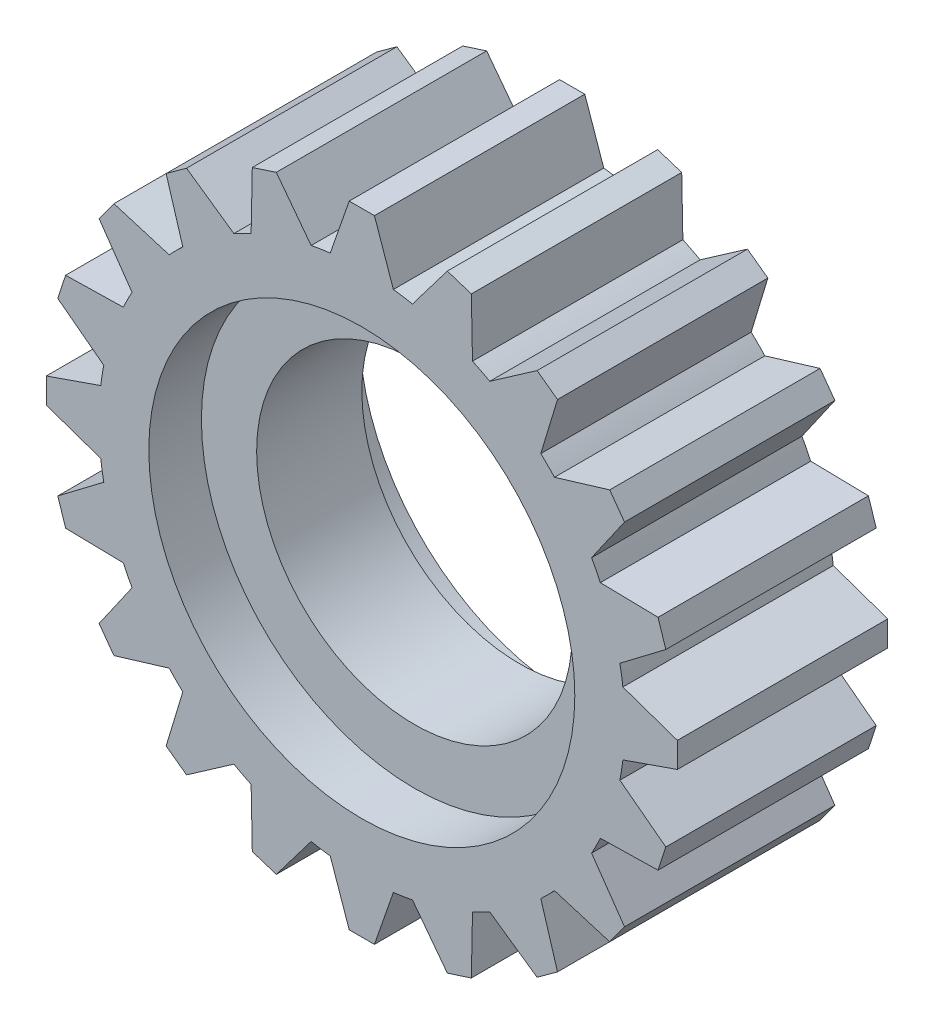
from build123d import *

# Parameters (mm, degrees)
BOSS_EXTRUDE1_DEPTH      = 10
BOSS_EXTRUDE1_DEPTH_BACK = 10
SKETCH1_R                = 15
SKETCH2_R                = 20.25
CUT_EXTRUDE1_DEPTH       = 5


with BuildPart() as part:
    # Sketch1 → Boss-Extrude1 (new, two sides: drawn at the far end of the back side and taken through both)
    with BuildSketch(Plane.XY.offset(-BOSS_EXTRUDE1_DEPTH_BACK)):
        with BuildLine():
            Line((-1.2, 30), (1.2, 30))
            Line((1.2, 30), (3, 24.819347292))
            ThreePointArc((3, 24.819347292), (3.910861626, 24.692208515), (4.816430554, 24.531652955))
            Line((4.816430554, 24.531652955), (8.129242012, 28.902515882))
            Line((8.129242012, 28.902515882), (10.411777651, 28.160875096))
            Line((10.411777651, 28.160875096), (10.522769651, 22.677550989))
            ThreePointArc((10.522769651, 22.677550989), (11.349762493, 22.275163105), (12.161395327, 21.842629505))
            Line((12.161395327, 21.842629505), (16.662737176, 24.975852134))
            Line((16.662737176, 24.975852134), (18.604377962, 23.565167528))
            Line((18.604377962, 23.565167528), (17.015497293, 18.315917992))
            ThreePointArc((17.015497293, 18.315917992), (17.67766953, 17.67766953), (18.315917992, 17.015497293))
            Line((18.315917992, 17.015497293), (23.565167528, 18.604377962))
            Line((23.565167528, 18.604377962), (24.975852134, 16.662737176))
            Line((24.975852134, 16.662737176), (21.842629505, 12.161395327))
            ThreePointArc((21.842629505, 12.161395327), (22.275163105, 11.349762493), (22.677550989, 10.522769651))
            Line((22.677550989, 10.522769651), (28.160875096, 10.411777651))
            Line((28.160875096, 10.411777651), (28.902515882, 8.129242012))
            Line((28.902515882, 8.129242012), (24.531652955, 4.816430554))
            ThreePointArc((24.531652955, 4.816430554), (24.692208515, 3.910861626), (24.819347292, 3))
            Line((24.819347292, 3), (30, 1.2))
            Line((30, 1.2), (30, -1.2))
            Line((30, -1.2), (24.819347292, -3))
            ThreePointArc((24.819347292, -3), (24.692208515, -3.910861626), (24.531652955, -4.816430554))
            Line((24.531652955, -4.816430554), (28.902515882, -8.129242012))
            Line((28.902515882, -8.129242012), (28.160875096, -10.411777651))
            Line((28.160875096, -10.411777651), (22.677550989, -10.522769651))
            ThreePointArc((22.677550989, -10.522769651), (22.275163105, -11.349762493), (21.842629505, -12.161395327))
            Line((21.842629505, -12.161395327), (24.975852134, -16.662737176))
            Line((24.975852134, -16.662737176), (23.565167528, -18.604377962))
            Line((23.565167528, -18.604377962), (18.315917992, -17.015497293))
            ThreePointArc((18.315917992, -17.015497293), (17.67766953, -17.67766953), (17.015497293, -18.315917992))
            Line((17.015497293, -18.315917992), (18.604377962, -23.565167528))
            Line((18.604377962, -23.565167528), (16.662737176, -24.975852134))
            Line((16.662737176, -24.975852134), (12.161395327, -21.842629505))
            ThreePointArc((12.161395327, -21.842629505), (11.349762493, -22.275163105), (10.522769651, -22.677550989))
            Line((10.522769651, -22.677550989), (10.411777651, -28.160875096))
            Line((10.411777651, -28.160875096), (8.129242012, -28.902515882))
            Line((8.129242012, -28.902515882), (4.816430554, -24.531652955))
            ThreePointArc((4.816430554, -24.531652955), (3.910861626, -24.692208515), (3, -24.819347292))
            Line((3, -24.819347292), (1.2, -30))
            Line((1.2, -30), (-1.2, -30))
            Line((-1.2, -30), (-3, -24.819347292))
            ThreePointArc((-3, -24.819347292), (-3.910861626, -24.692208515), (-4.816430554, -24.531652955))
            Line((-4.816430554, -24.531652955), (-8.129242012, -28.902515882))
            Line((-8.129242012, -28.902515882), (-10.411777651, -28.160875096))
            Line((-10.411777651, -28.160875096), (-10.522769651, -22.677550989))
            ThreePointArc((-10.522769651, -22.677550989), (-11.349762493, -22.275163105), (-12.161395327, -21.842629505))
            Line((-12.161395327, -21.842629505), (-16.662737176, -24.975852134))
            Line((-16.662737176, -24.975852134), (-18.604377962, -23.565167528))
            Line((-18.604377962, -23.565167528), (-17.015497293, -18.315917992))
            ThreePointArc((-17.015497293, -18.315917992), (-17.67766953, -17.67766953), (-18.315917992, -17.015497293))
            Line((-18.315917992, -17.015497293), (-23.565167528, -18.604377962))
            Line((-23.565167528, -18.604377962), (-24.975852134, -16.662737176))
            Line((-24.975852134, -16.662737176), (-21.842629505, -12.161395327))
            ThreePointArc((-21.842629505, -12.161395327), (-22.275163105, -11.349762493), (-22.677550989, -10.522769651))
            Line((-22.677550989, -10.522769651), (-28.160875096, -10.411777651))
            Line((-28.160875096, -10.411777651), (-28.902515882, -8.129242012))
            Line((-28.902515882, -8.129242012), (-24.531652955, -4.816430554))
            ThreePointArc((-24.531652955, -4.816430554), (-24.692208515, -3.910861626), (-24.819347292, -3))
            Line((-24.819347292, -3), (-30, -1.2))
            Line((-30, -1.2), (-30, 1.2))
            Line((-30, 1.2), (-24.819347292, 3))
            ThreePointArc((-24.819347292, 3), (-24.692208515, 3.910861626), (-24.531652955, 4.816430554))
            Line((-24.531652955, 4.816430554), (-28.902515882, 8.129242012))
            Line((-28.902515882, 8.129242012), (-28.160875096, 10.411777651))
            Line((-28.160875096, 10.411777651), (-22.677550989, 10.522769651))
            ThreePointArc((-22.677550989, 10.522769651), (-22.275163105, 11.349762493), (-21.842629505, 12.161395327))
            Line((-21.842629505, 12.161395327), (-24.975852134, 16.662737176))
            Line((-24.975852134, 16.662737176), (-23.565167528, 18.604377962))
            Line((-23.565167528, 18.604377962), (-18.315917992, 17.015497293))
            ThreePointArc((-18.315917992, 17.015497293), (-17.67766953, 17.67766953), (-17.015497293, 18.315917992))
            Line((-17.015497293, 18.315917992), (-18.604377962, 23.565167528))
            Line((-18.604377962, 23.565167528), (-16.662737176, 24.975852134))
            Line((-16.662737176, 24.975852134), (-12.161395327, 21.842629505))
            ThreePointArc((-12.161395327, 21.842629505), (-11.349762493, 22.275163105), (-10.522769651, 22.677550989))
            Line((-10.522769651, 22.677550989), (-10.411777651, 28.160875096))
            Line((-10.411777651, 28.160875096), (-8.129242012, 28.902515882))
            Line((-8.129242012, 28.902515882), (-4.816430554, 24.531652955))
            ThreePointArc((-4.816430554, 24.531652955), (-3.910861626, 24.692208515), (-3, 24.819347292))
            Line((-3, 24.819347292), (-1.2, 30))
        make_face()
        Circle(SKETCH1_R, mode=Mode.SUBTRACT)
    extrude(amount=BOSS_EXTRUDE1_DEPTH + BOSS_EXTRUDE1_DEPTH_BACK)

    # Sketch2 → Cut-Extrude1 (cut)
    with BuildSketch(Plane.XY.offset(10)):
        Circle(SKETCH2_R)
    cut_extrude1 = extrude(amount=-CUT_EXTRUDE1_DEPTH, mode=Mode.SUBTRACT)

    # Mirror1: Cut-Extrude1 across plane
    add(cut_extrude1.mirror(Plane.XY), mode=Mode.SUBTRACT)


solid = part.part
